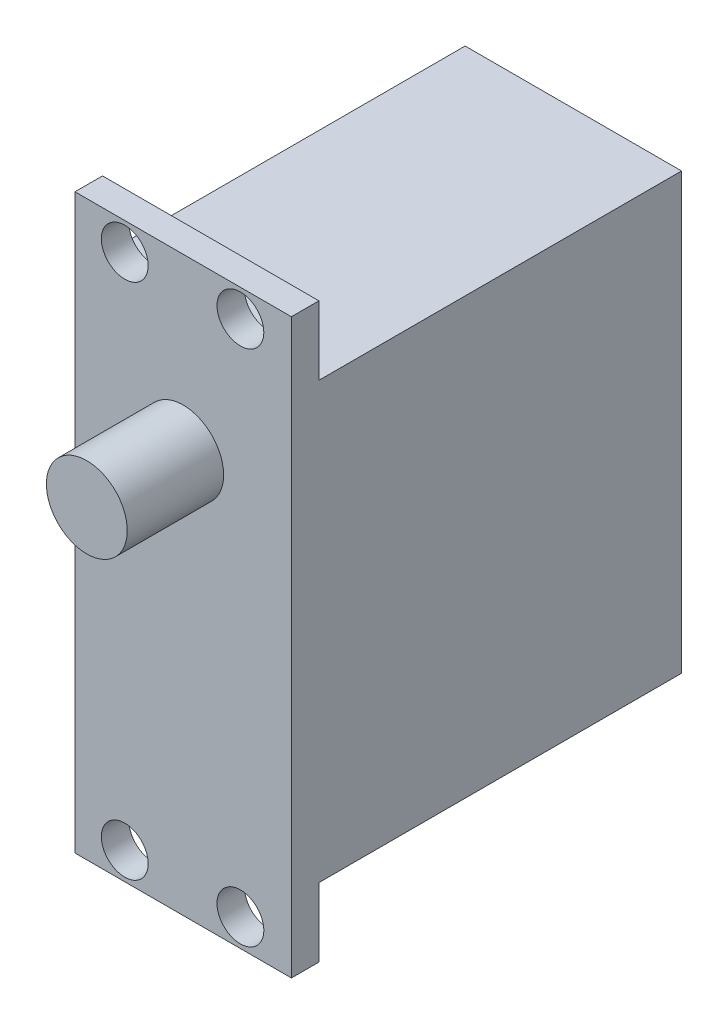
from build123d import *

# Parameters (mm, degrees)
SKETCH1_W      = 35.9918
SKETCH1_H      = 40.132
EXTRUDE1_DEPTH = 9.9822
SKETCH2_R      = 3.730476731
EXTRUDE2_DEPTH = 8.89
SKETCH5_W      = 19.9644
SKETCH5_H      = 6.35
SKETCH5_R      = 2.159
EXTRUDE5_DEPTH = 2.54


with BuildPart() as part:
    # Sketch1 → Extrude1 (new, symmetric)
    with BuildSketch(Plane(origin=(0, 0, 0), x_dir=(0, 0, -1), z_dir=(1, 0, 0))):
        with Locations((-36.920443218, 16.936283292)):
            Rectangle(SKETCH1_W, SKETCH1_H)
    extrude(amount=EXTRUDE1_DEPTH, both=True)

    # Sketch5 → Extrude5 (add)
    # profile 1 of 2: a face of its own
    with BuildSketch(Plane.XY.offset(54.916343218)):
        with Locations((0, 40.177283292)):
            Rectangle(SKETCH5_W, SKETCH5_H)
        with Locations((5.278089528, 40.821765348)):
            Circle(SKETCH5_R, mode=Mode.SUBTRACT)
        with Locations((-5.389910472, 40.821765348)):
            Circle(SKETCH5_R, mode=Mode.SUBTRACT)
    # profile 2 of 2: a face of its own
    with BuildSketch(Plane.XY.offset(54.916343218)):
        with Locations((0, -6.304716708)):
            Rectangle(SKETCH5_W, SKETCH5_H)
        with Locations(Location((-5.389910472, -6.949198764, 0), (0, 0, 180))):
            Circle(SKETCH5_R, mode=Mode.SUBTRACT)
        with Locations(Location((5.278089528, -6.949198764, 0), (0, 0, 180))):
            Circle(SKETCH5_R, mode=Mode.SUBTRACT)
    extrude(amount=-EXTRUDE5_DEPTH)


with BuildPart() as body_2:
    # Sketch2 → Extrude2 (new body)
    with BuildSketch(Plane.XY.offset(54.916343218)):
        with Locations((0, 27.578883292)):
            Circle(SKETCH2_R)
    extrude(amount=EXTRUDE2_DEPTH)


solid = Compound([part.part, body_2.part])
